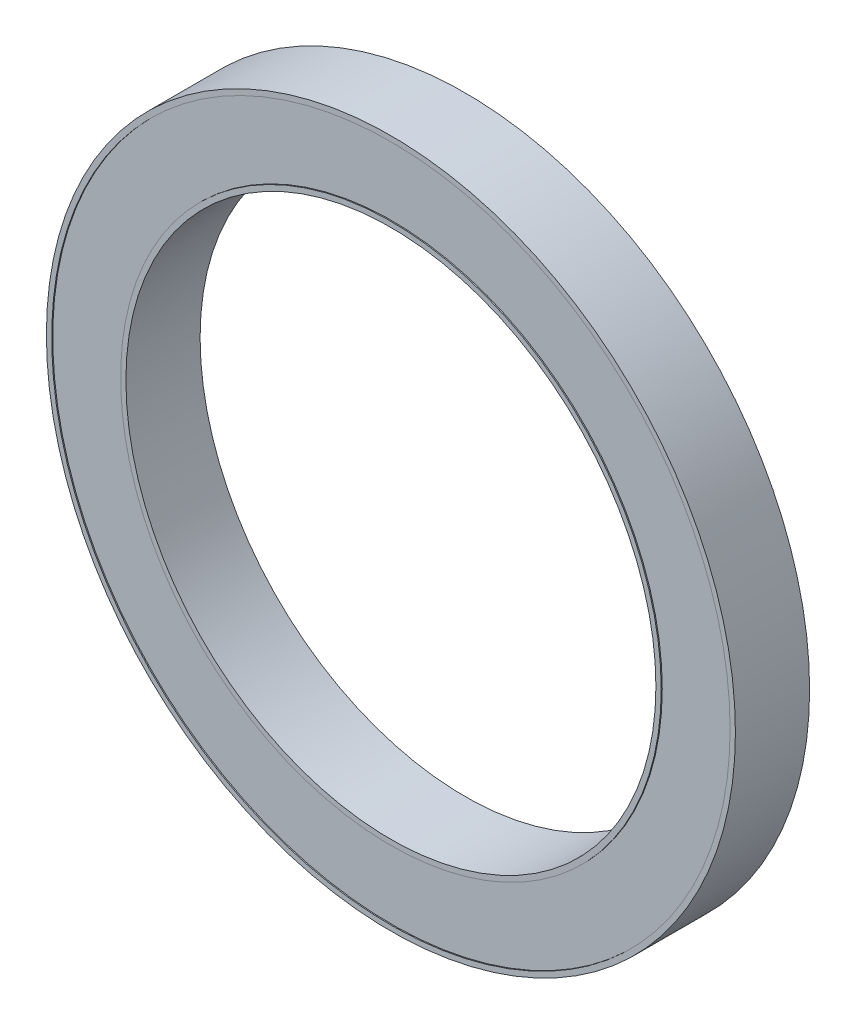
from build123d import *

# Parameters (mm, degrees)
SKETCH1_R           = 32.5
SKETCH1_R_2         = 25
BOSS_EXTRUDE1_DEPTH = 7
SKETCH2_R           = 32
SKETCH2_R_2         = 25.5
CUT_EXTRUDE1_DEPTH  = 0.1
CUT_EXTRUDE2_START  = -0.1
SKETCH3_R           = 32
SKETCH3_R_2         = 25.5
CUT_EXTRUDE2_DEPTH  = 0.1


with BuildPart() as part:
    # Sketch1 → Boss-Extrude1 (new body)
    with BuildSketch(Plane.XY):
        Circle(SKETCH1_R)
        Circle(SKETCH1_R_2, mode=Mode.SUBTRACT)
    extrude(amount=BOSS_EXTRUDE1_DEPTH)

    # Sketch2 → Cut-Extrude1 (cut)
    with BuildSketch(Plane(origin=(0, 0, 0), x_dir=(-1, 0, 0), z_dir=(0, 0, -1))):
        Circle(SKETCH2_R)
        Circle(SKETCH2_R_2, mode=Mode.SUBTRACT)
    extrude(amount=-CUT_EXTRUDE1_DEPTH, mode=Mode.SUBTRACT)

    # Sketch3 → Cut-Extrude2 (cut)
    with BuildSketch(Plane.XY.offset(7).offset(CUT_EXTRUDE2_START)):
        with Locations(Location((0, 0, 0), (0, 0, 180))):
            Circle(SKETCH3_R)
        with Locations(Location((0, 0, 0), (0, 0, 180))):
            Circle(SKETCH3_R_2, mode=Mode.SUBTRACT)
    extrude(amount=CUT_EXTRUDE2_DEPTH, mode=Mode.SUBTRACT)


solid = part.part
